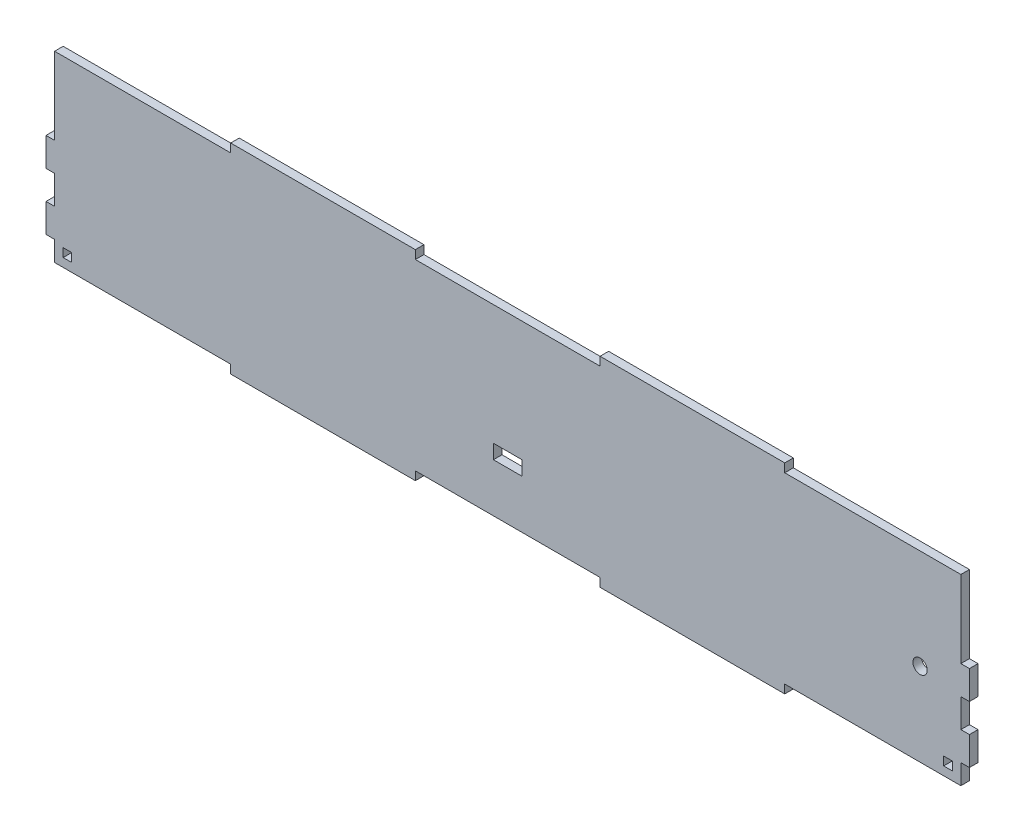
from build123d import *

# Parameters (mm, degrees)
SKETCH1_R           = 2.5
SKETCH1_W           = 3
SKETCH1_H           = 3
SKETCH1_W_2         = 10
SKETCH1_H_2         = 5
BOSS_EXTRUDE1_DEPTH = 3


with BuildPart() as part:
    # Sketch1 → Boss-Extrude1 (new body)
    with BuildSketch(Plane.XY):
        Polygon((0, 39.585266036), (0, 29.585266036), (3, 29.585266036), (3, 19.585266036), (0, 19.585266036), (0, 9.585266036), (3, 9.585266036), (3, 2.585266036), (64.6, 2.585266036), (64.6, -0.414733964), (129.2, -0.414733964), (129.2, 2.585266036), (193.8, 2.585266036), (193.8, -0.414733964), (258.4, -0.414733964), (258.4, 2.585266036), (320, 2.585266036), (320, 9.585266036), (323, 9.585266036), (323, 19.585266036), (320, 19.585266036), (320, 29.585266036), (323, 29.585266036), (323, 39.585266036), (320, 39.585266036), (320, 66.585266036), (258.4, 66.585266036), (258.4, 69.585266036), (193.8, 69.585266036), (193.8, 66.585266036), (129.2, 66.585266036), (129.2, 69.585266036), (64.6, 69.585266036), (64.6, 66.585266036), (3, 66.585266036), (3, 39.585266036), align=None)
        with Locations((305.733190997, 31.662269088)):
            Circle(SKETCH1_R, mode=Mode.SUBTRACT)
        with Locations((315.5, 7.085266036)):
            Rectangle(SKETCH1_W, SKETCH1_H, mode=Mode.SUBTRACT)
        with Locations((7.5, 7.085266036)):
            Rectangle(SKETCH1_W, SKETCH1_H, mode=Mode.SUBTRACT)
        with Locations((161.5, 22.085266036)):
            Rectangle(SKETCH1_W_2, SKETCH1_H_2, mode=Mode.SUBTRACT)
    extrude(amount=BOSS_EXTRUDE1_DEPTH)


solid = part.part
